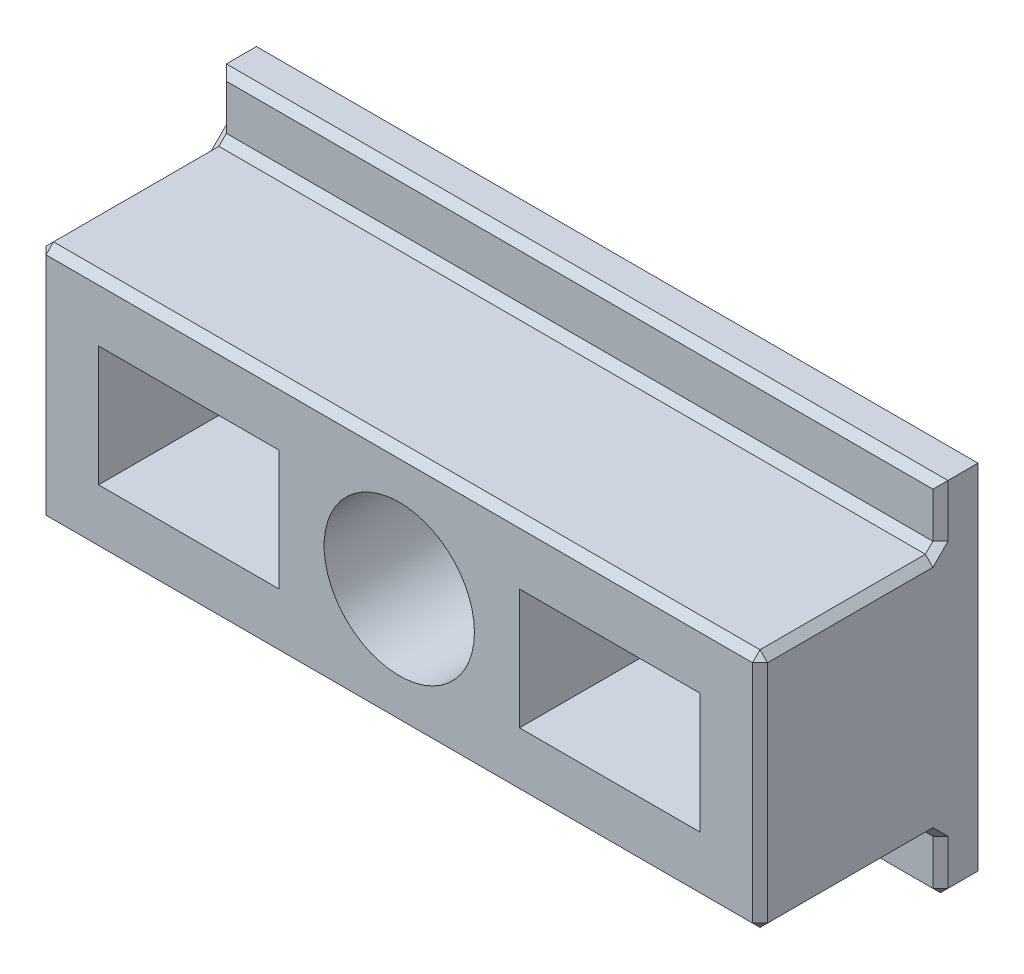
from build123d import *

# Parameters (mm, degrees)
SKETCH1_W           = 24
SKETCH1_H           = 8
BOSS_EXTRUDE1_DEPTH = 6
SKETCH2_W           = 24
SKETCH2_H           = 12
BOSS_EXTRUDE2_DEPTH = 1.5
SKETCH3_R           = 2.5
SKETCH3_W           = 6
SKETCH3_H           = 4
CUT_EXTRUDE1_DEPTH  = 16.370426149
CHAMFER1_SIZE       = 0.25


with BuildPart() as part:
    # Sketch1 → Boss-Extrude1 (new body)
    with BuildSketch(Plane.XY):
        Rectangle(SKETCH1_W, SKETCH1_H)
    extrude(amount=-BOSS_EXTRUDE1_DEPTH)

    # Sketch2 → Boss-Extrude2 (add)
    with BuildSketch(Plane(origin=(0, 0, -6), x_dir=(-1, 0, 0), z_dir=(0, 0, -1))):
        Rectangle(SKETCH2_W, SKETCH2_H)
    extrude(amount=BOSS_EXTRUDE2_DEPTH)

    # Sketch3 → Cut-Extrude1 (cut, through all)
    with BuildSketch(Plane.XY):
        Circle(SKETCH3_R)
        with Locations((-7, 0)):
            Rectangle(SKETCH3_W, SKETCH3_H)
        with Locations((7, 0)):
            Rectangle(SKETCH3_W, SKETCH3_H)
    extrude(amount=-CUT_EXTRUDE1_DEPTH, mode=Mode.SUBTRACT)

    # Chamfer1
    chamfer1_edges = [part.edges().sort_by_distance(p)[0] for p in [
        (12, 5, -6),
        (12, -5, -6),
        (0, -6, -6),
        (12, -6, -6.75),
        (-12, -5, -6),
        (0, 4, -6),
        (-12, 5, -6),
        (0, 6, -6),
        (12, 0, -7.5),
        (0, -6, -7.5),
        (-12, 0, -7.5),
        (0, 6, -7.5),
        (0, 4, 0),
        (12, 0, 0),
        (0, -4, 0),
        (-12, 0, 0),
        (-12, 4, -3),
        (12, 4, -3),
        (12, -4, -3),
        (-12, -4, -3),
        (0, -4, -6),
    ]]
    chamfer(chamfer1_edges, length=CHAMFER1_SIZE)


solid = part.part
